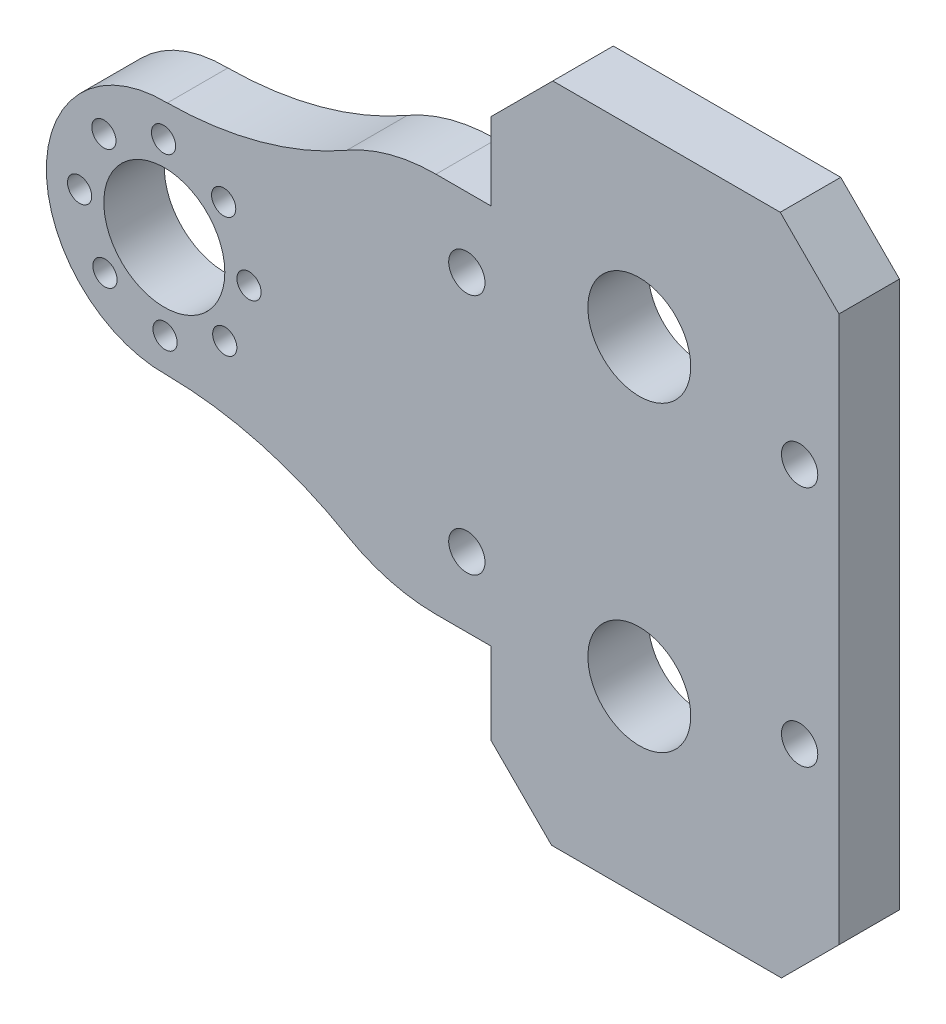
from build123d import *

# Parameters (mm, degrees)
SKETCH1_R           = 1.5
SKETCH1_R_2         = 4.25
SKETCH1_R_3         = 1
BOSS_EXTRUDE2_DEPTH = 5
SKETCH2_R           = 5
CUT_EXTRUDE1_DEPTH  = 10


with BuildPart() as part:
    # Sketch1 → Boss-Extrude2 (new body)
    with BuildSketch(Plane.XY):
        with BuildLine():
            Line((45.25091594, -25.207708346), (50.00091594, -20.457708346))
            Line((50.00091594, -20.457708346), (50.00091594, 24.688738263))
            Line((50.00091594, 24.688738263), (45.147362549, 29.542291654))
            Line((45.147362549, 29.542291654), (26.35446933, 29.542291654))
            Line((26.35446933, 29.542291654), (21.25091594, 24.438738263))
            Line((21.25091594, 24.438738263), (21.25091594, 18.042291654))
            Line((21.25091594, 18.042291654), (20.408095363, 18.042291654))
            Line((20.408095363, 18.042291654), (16.70086026, 18.042291654))
            ThreePointArc((16.70086026, 18.042291654), (12.892426636, 17.542145454), (9.3422674, 16.075624987))
            ThreePointArc((9.3422674, 16.075624987), (2.182128173, 13.100539865), (-5.49908406, 12.043324729))
            Line((-5.49908406, 12.043324729), (-5.49908406, 12.039085999))
            ThreePointArc((-5.49908406, 12.039085999), (-15.49908406, 2.292291654), (-5.49908406, -7.454502691))
            Line((-5.49908406, -7.454502691), (-5.49908406, -7.458741422))
            ThreePointArc((-5.49908406, -7.458741422), (2.182128173, -8.515956557), (9.3422674, -11.491041679))
            ThreePointArc((9.3422674, -11.491041679), (12.892426636, -12.957562146), (16.70086026, -13.457708346))
            Line((16.70086026, -13.457708346), (20.408095363, -13.457708346))
            Line((20.408095363, -13.457708346), (21.25091594, -13.457708346))
            Line((21.25091594, -13.457708346), (21.25091594, -20.207708346))
            Line((21.25091594, -20.207708346), (26.25091594, -25.207708346))
            Line((26.25091594, -25.207708346), (45.25091594, -25.207708346))
        make_face()
        with Locations((46.75091594, -7.707708346)):
            Circle(SKETCH1_R, mode=Mode.SUBTRACT)
        with Locations((46.75091594, 12.292291654)):
            Circle(SKETCH1_R, mode=Mode.SUBTRACT)
        with Locations((33.50091594, 14.792291654)):
            Circle(SKETCH1_R_2, mode=Mode.SUBTRACT)
        with Locations((33.50091594, -10.207708346)):
            Circle(SKETCH1_R_2, mode=Mode.SUBTRACT)
        with Locations((19.25091594, 12.292291654)):
            Circle(SKETCH1_R, mode=Mode.SUBTRACT)
        with Locations((19.25091594, -7.707708346)):
            Circle(SKETCH1_R, mode=Mode.SUBTRACT)
        with Locations((-5.74908406, 2.292291654)):
            Circle(SKETCH1_R, mode=Mode.SUBTRACT)
        with Locations((1.25091594, 2.354746229)):
            Circle(SKETCH1_R_3, mode=Mode.SUBTRACT)
        with Locations((-0.755373293, -2.613098521)):
            Circle(SKETCH1_R_3, mode=Mode.SUBTRACT)
        with Locations((-5.686629485, -4.707708346)):
            Circle(SKETCH1_R_3, mode=Mode.SUBTRACT)
        with Locations((-10.654474236, -2.701419114)):
            Circle(SKETCH1_R_3, mode=Mode.SUBTRACT)
        with Locations((-12.74908406, 2.229837079)):
            Circle(SKETCH1_R_3, mode=Mode.SUBTRACT)
        with Locations((-10.742794828, 7.197681829)):
            Circle(SKETCH1_R_3, mode=Mode.SUBTRACT)
        with Locations((-5.811538636, 9.292291654)):
            Circle(SKETCH1_R_3, mode=Mode.SUBTRACT)
        with Locations((-0.843693885, 7.286002421)):
            Circle(SKETCH1_R_3, mode=Mode.SUBTRACT)
    extrude(amount=BOSS_EXTRUDE2_DEPTH)

    # Sketch2 → Cut-Extrude1 (cut)
    with BuildSketch(Plane.XY.offset(5)):
        with Locations((-5.74908406, 2.292291654)):
            Circle(SKETCH2_R)
    extrude(amount=-CUT_EXTRUDE1_DEPTH, mode=Mode.SUBTRACT)


solid = part.part
